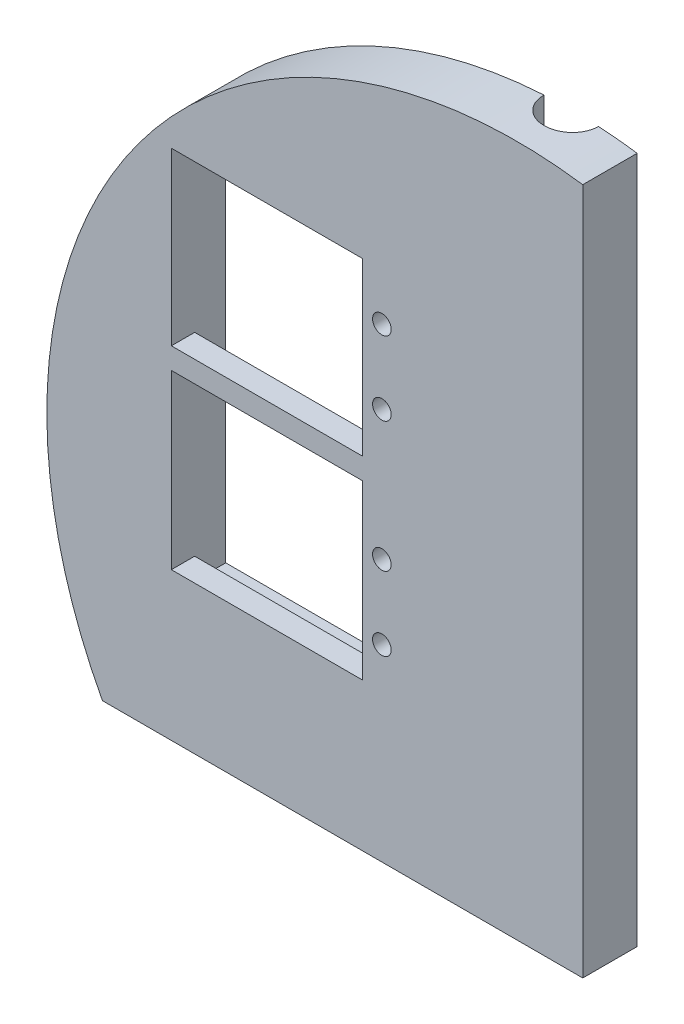
from build123d import *

# Parameters (mm, degrees)
SKETCH1_R                                       = 60.5
BOSS_EXTRUDE1_DEPTH                             = 7
SKETCH6_R                                       = 3.5
CUT_EXTRUDE2_DEPTH                              = 70
CUT_EXTRUDE7_DEPTH                              = 10
SKETCH23_W                                      = 42.472377856
SKETCH23_H                                      = 49.728625228
CUT_EXTRUDE8_DEPTH                              = 4
SKETCH24_W                                      = 49.728625228
SKETCH24_H                                      = 1.127718677
CUT_EXTRUDE10_DEPTH                             = 1
CSK_FOR_M2_FLAT_HEAD_MACHINE_SCREW1_D           = 2.4
CSK_FOR_M2_FLAT_HEAD_MACHINE_SCREW1_CSINK_D     = 4.4
CSK_FOR_M2_FLAT_HEAD_MACHINE_SCREW1_CSINK_ANGLE = 90
SKETCH30_W                                      = 24.590301857
SKETCH30_H                                      = 22.033921334
CUT_EXTRUDE11_DEPTH                             = 10
SKETCH39_R                                      = 2.5
CUT_EXTRUDE14_DEPTH                             = 13
SKETCH42_R                                      = 4.5
CUT_EXTRUDE15_DEPTH                             = 1.5
SKETCH43_W                                      = 2.738349456
SKETCH43_H                                      = 1.372281323
CUT_EXTRUDE17_DEPTH                             = 1


with BuildPart() as part:
    # Sketch1 → Boss-Extrude1 (new body)
    with BuildSketch(Plane(origin=(0, 0, 0), x_dir=(0, 1, 0), z_dir=(0, 0, 1))):
        Circle(SKETCH1_R)
    extrude(amount=BOSS_EXTRUDE1_DEPTH)

    # Sketch6 → Cut-Extrude2 (cut)
    with BuildSketch(Plane(origin=(0, 60.5, -6), x_dir=(-1, 0, 0), z_dir=(0, 1, 0))):
        with Locations((0, 6)):
            Circle(SKETCH6_R)
    extrude(amount=-CUT_EXTRUDE2_DEPTH, mode=Mode.SUBTRACT)

    # Sketch21 → Cut-Extrude7 (cut)
    with BuildSketch(Plane.XY.offset(7)):
        with BuildLine():
            Line((8.487846034, 59.901639958), (8.487846034, -28.542105861))
            Line((8.487846034, -28.542105861), (-53.344148629, -28.542105861))
            ThreePointArc((-53.344148629, -28.542105861), (113.000185213, -78.999671309), (8.487846034, 59.901639958))
        make_face()
    extrude(amount=-CUT_EXTRUDE7_DEPTH, mode=Mode.SUBTRACT)

    # Sketch23 → Cut-Extrude8 (cut)
    with BuildSketch(Plane(origin=(0, 0, 0), x_dir=(1, 0, 0), z_dir=(0, 0, -1))):
        with Locations((-23.236188928, -12.625963158)):
            Rectangle(SKETCH23_W, SKETCH23_H)
    extrude(amount=-CUT_EXTRUDE8_DEPTH, mode=Mode.SUBTRACT)

    # Sketch24 → Cut-Extrude10 (cut)
    with BuildSketch(Plane(origin=(-2, 0, 0), x_dir=(0, -1, 0), z_dir=(-1, 0, 0))):
        with Locations((-12.625963158, 3.436140662)):
            Rectangle(SKETCH24_W, SKETCH24_H)
    extrude(amount=-CUT_EXTRUDE10_DEPTH, mode=Mode.SUBTRACT)

    # CSK for M2 Flat Head Machine Screw1 (through all)
    with Locations(Plane.YX.offset(-4)):
        with Locations((-4.307531, -17.373644116), (5.192468135, -17.377696999), (21.926905074, -17.371512218), (31.426905074, -17.371512218)):
            CounterSinkHole(CSK_FOR_M2_FLAT_HEAD_MACHINE_SCREW1_D / 2, CSK_FOR_M2_FLAT_HEAD_MACHINE_SCREW1_CSINK_D / 2, counter_sink_angle=CSK_FOR_M2_FLAT_HEAD_MACHINE_SCREW1_CSINK_ANGLE)

    # Sketch30 → Cut-Extrude11 (cut)
    with BuildSketch(Plane(origin=(0, 0, 4), x_dir=(1, 0, 0), z_dir=(0, 0, -1))):
        with Locations((-32.177226928, -26.473315105)):
            Rectangle(SKETCH30_W, SKETCH30_H)
        Polygon((-19.882075999, -12.713705866), (-44.472377856, -12.713705866), (-44.472377856, 9.50080752), (-19.871510792, 9.50080752), align=None)
    extrude(amount=-CUT_EXTRUDE11_DEPTH, mode=Mode.SUBTRACT)

    # Sketch39 → Cut-Extrude14 (cut)
    with BuildSketch(Plane(origin=(0, -9.5, 0), x_dir=(-1, 0, 0), z_dir=(0, 1, 0))):
        Circle(SKETCH39_R)
    extrude(amount=-CUT_EXTRUDE14_DEPTH, mode=Mode.SUBTRACT)

    # Sketch42 → Cut-Extrude15 (cut, symmetric)
    with BuildSketch(Plane(origin=(0, -15.738349456, 0), x_dir=(-1, 0, 0), z_dir=(0, 1, 0))):
        Circle(SKETCH42_R)
    extrude(amount=CUT_EXTRUDE15_DEPTH, both=True, mode=Mode.SUBTRACT)

    # Sketch43 → Cut-Extrude17 (cut)
    with BuildSketch(Plane(origin=(-2, 0, 0), x_dir=(0, -1, 0), z_dir=(-1, 0, 0))):
        with Locations((10.869174728, 2.186140662)):
            Rectangle(SKETCH43_W, SKETCH43_H)
    extrude(amount=-CUT_EXTRUDE17_DEPTH, mode=Mode.SUBTRACT)


solid = part.part
